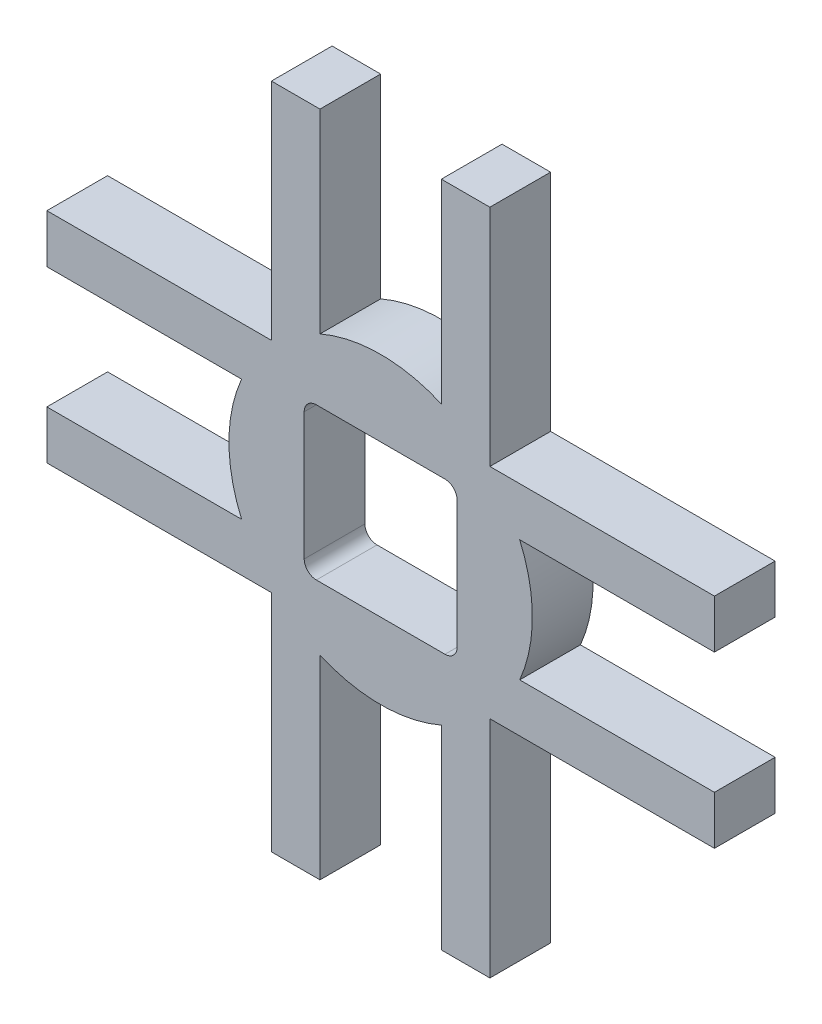
from build123d import *

# Parameters (mm, degrees)
SKETCH1_R           = 12.5
BOSS_EXTRUDE1_DEPTH = 2.5
SKETCH4_W           = 4
SKETCH4_H           = 27.5
BOSS_EXTRUDE3_DEPTH = 5
CIRPATTERN7_COUNT   = 4
CUT_EXTRUDE3_REACH  = 41.211
SKETCH8_W           = 12.6
SKETCH8_H           = 12.5
FILLET1_R           = 1


with BuildPart() as part:
    # Sketch1 → Boss-Extrude1 (new, symmetric)
    with BuildSketch(Plane.XY):
        Circle(SKETCH1_R)
    extrude(amount=BOSS_EXTRUDE1_DEPTH, both=True)

    # Sketch4 → Boss-Extrude3 (add)
    with BuildSketch(Plane.XY.offset(2.5)):
        with Locations((-7, 13.75)):
            Rectangle(SKETCH4_W, SKETCH4_H)
        with Locations((7, 13.75)):
            Rectangle(SKETCH4_W, SKETCH4_H)
    boss_extrude3 = extrude(amount=-BOSS_EXTRUDE3_DEPTH)

    # CirPattern7: Boss-Extrude3 ×4 about axis
    cirpattern7_axis = Axis((0, 0, 0), (0, 0, 1))
    for i in range(1, CIRPATTERN7_COUNT):
        add(boss_extrude3.rotate(cirpattern7_axis, i * 360 / CIRPATTERN7_COUNT))

    # Sketch8 → Cut-Extrude3 (cut, up to next)
    with BuildSketch(Plane.XY.offset(2.5), mode=Mode.PRIVATE) as cut_extrude3_sk1:
        Rectangle(SKETCH8_W, SKETCH8_H)
    cut_extrude3_tool1 = extrude(cut_extrude3_sk1.sketch, amount=-CUT_EXTRUDE3_REACH, mode=Mode.PRIVATE) & part.part
    add(cut_extrude3_tool1.solids().sort_by_distance((0, 0, 2.5))[0], mode=Mode.SUBTRACT)

    # Fillet1
    fillet1_edges = [part.edges().sort_by_distance(p)[0] for p in [
        (6.3, 6.25, 0),
        (6.3, -6.25, 0),
        (-6.3, -6.25, 0),
        (-6.3, 6.25, 0),
    ]]
    fillet(fillet1_edges, radius=FILLET1_R)


solid = part.part
